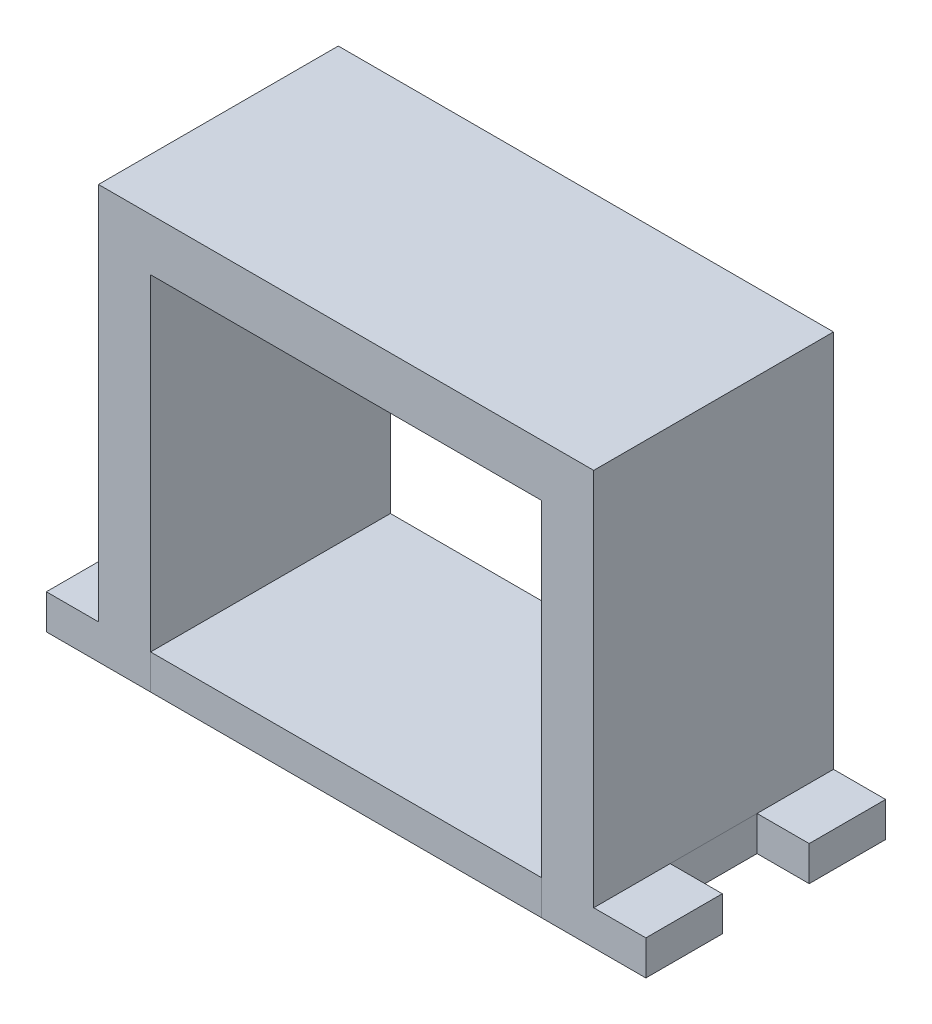
from build123d import *

# Parameters (mm, degrees)
SKETCH1_W            = 28.5
SKETCH1_H            = 13.8
BOSS_EXTRUDE1_DEPTH  = 3
SKETCH1_4_R          = 1.9
CUT_EXTRUDE1_DEPTH   = 2
SKETCH1_6_W          = 3
SKETCH1_6_H          = 13.8
BOSS_EXTRUDE2_DEPTH  = 18.8
SKETCH3_W            = 3
SKETCH3_H            = 4.4
BOSS_EXTRUDE6_DEPTH  = 2
SKETCH3_7_W          = 3
SKETCH3_7_H          = 4.4
BOSS_EXTRUDE12_DEPTH = 2
BOSS_EXTRUDE13_DEPTH = 2


with BuildPart() as part:
    # Sketch1 → Boss-Extrude1 (new body)
    with BuildSketch(Plane(origin=(0, 0, 0), x_dir=(1, 0, 0), z_dir=(0, 1, 0))):
        Rectangle(SKETCH1_W, SKETCH1_H)
    extrude(amount=BOSS_EXTRUDE1_DEPTH)

    # Sketch1<4> → Cut-Extrude1 (cut)
    with BuildSketch(Plane(origin=(0, 0, 0), x_dir=(1, 0, 0), z_dir=(0, 1, 0))):
        Circle(SKETCH1_4_R)
    extrude(amount=CUT_EXTRUDE1_DEPTH, mode=Mode.SUBTRACT)

    # Sketch1<6> → Boss-Extrude2 (add)
    with BuildSketch(Plane(origin=(0, 0, 0), x_dir=(1, 0, 0), z_dir=(0, 1, 0))):
        with Locations((-12.75, 0)):
            Rectangle(SKETCH1_6_W, SKETCH1_6_H)
        with Locations((12.75, 0)):
            Rectangle(SKETCH1_6_W, SKETCH1_6_H)
    extrude(amount=-BOSS_EXTRUDE2_DEPTH)

    # Sketch3 → Boss-Extrude6 (add)
    with BuildSketch(Plane.XZ.offset(18.8)):
        with Locations((-12.75, -4.7)):
            Rectangle(SKETCH3_W, SKETCH3_H)
        with Locations((-12.75, 4.7)):
            Rectangle(SKETCH3_W, SKETCH3_H)
        with Locations((12.75, -4.7)):
            Rectangle(SKETCH3_W, SKETCH3_H)
        with Locations((12.75, 4.7)):
            Rectangle(SKETCH3_W, SKETCH3_H)
    extrude(amount=BOSS_EXTRUDE6_DEPTH)

    # Sketch3<7> → Boss-Extrude12 (add)
    with BuildSketch(Plane.XZ.offset(18.8)):
        with Locations((-15.75, -4.7)):
            Rectangle(SKETCH3_7_W, SKETCH3_7_H)
        with Locations((-15.75, 4.7)):
            Rectangle(SKETCH3_7_W, SKETCH3_7_H)
        with Locations((15.75, -4.7)):
            Rectangle(SKETCH3_7_W, SKETCH3_7_H)
        with Locations((15.75, 4.7)):
            Rectangle(SKETCH3_7_W, SKETCH3_7_H)
    extrude(amount=BOSS_EXTRUDE12_DEPTH)


with BuildPart() as body_2:
    # Sketch3<8> → Boss-Extrude13 (new body)
    with BuildSketch(Plane.XZ.offset(18.8)):
        Polygon((-14.25, 2.5), (-14.25, -2.5), (-11.25, -2.5), (-11.25, -6.9), (11.25, -6.9), (11.25, -2.5), (14.25, -2.5), (14.25, 2.5), (11.25, 2.5), (11.25, 6.9), (-11.25, 6.9), (-11.25, 2.5), align=None)
    extrude(amount=BOSS_EXTRUDE13_DEPTH)


solid = Compound([part.part, body_2.part])
